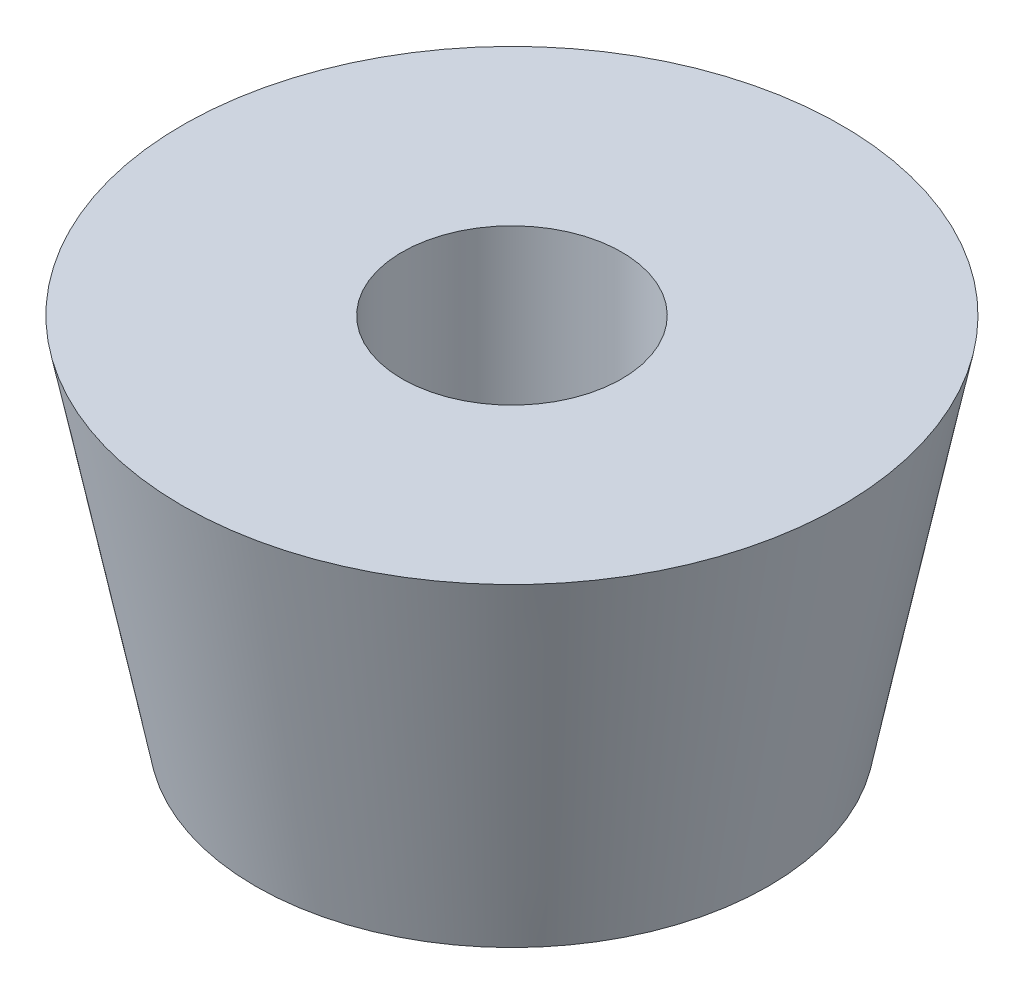
from build123d import *


with BuildPart() as part:
    # Sketch1 → Revolve1 (revolve)
    with BuildSketch(Plane(origin=(0, 0, 0), x_dir=(0, 0, -1), z_dir=(1, 0, 0)), mode=Mode.PRIVATE) as revolve1_sk:
        Polygon((6, 0), (6, -20), (14, -20), (18, 0), align=None)
    revolve(revolve1_sk.sketch.rotate(Axis((0, 0, 0), (0, -1, 0)), 180), axis=Axis((0, 0, 0), (0, -1, 0)))


solid = part.part
